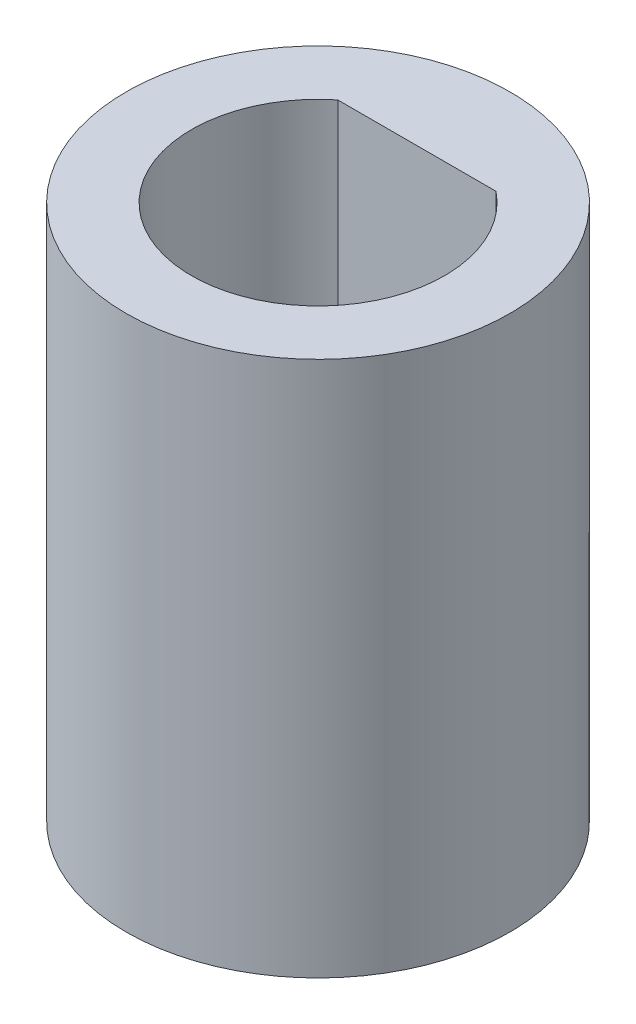
from build123d import *

# Parameters (mm, degrees)
SKETCH1_R           = 5.875
BOSS_EXTRUDE1_DEPTH = 16.4
CUT_EXTRUDE1_DEPTH  = 19.384538341


with BuildPart() as part:
    # Sketch1 → Boss-Extrude1 (new body)
    with BuildSketch(Plane(origin=(0, 0, 0), x_dir=(1, 0, 0), z_dir=(0, 1, 0))):
        Circle(SKETCH1_R)
    extrude(amount=-BOSS_EXTRUDE1_DEPTH)

    # Sketch3 → Cut-Extrude1 (cut, through all)
    with BuildSketch(Plane(origin=(0, 0, 0), x_dir=(1, 0, 0), z_dir=(0, 1, 0))):
        with BuildLine():
            Line((-2.421776208, 3.025), (2.421776208, 3.025))
            ThreePointArc((2.421776208, 3.025), (0, -3.875), (-2.421776208, 3.025))
        make_face()
    extrude(amount=-CUT_EXTRUDE1_DEPTH, mode=Mode.SUBTRACT)


solid = part.part
